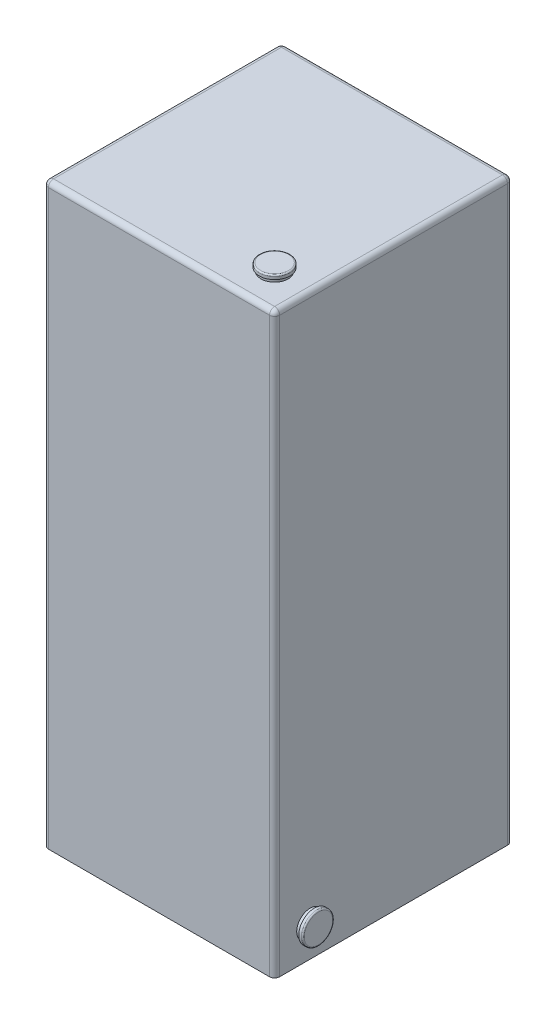
from build123d import *

# Parameters (mm, degrees)
CROQUIS1_W              = 680
CROQUIS1_H              = 1700
SALIENTE_EXTRUIR1_DEPTH = 700
REDONDEO1_R             = 15
CROQUIS4_R              = 40
SALIENTE_EXTRUIR4_DEPTH = 22
CROQUIS5_R              = 45
SALIENTE_EXTRUIR5_DEPTH = 12
REDONDEO3_R             = 4
CROQUIS6_R              = 40
SALIENTE_EXTRUIR6_DEPTH = 24
CROQUIS7_R              = 46
SALIENTE_EXTRUIR7_DEPTH = 12
REDONDEO5_R             = 4


with BuildPart() as part:
    # Croquis1 → Saliente-Extruir1 (new body)
    with BuildSketch(Plane.XY):
        with Locations((340, 850)):
            Rectangle(CROQUIS1_W, CROQUIS1_H)
    extrude(amount=SALIENTE_EXTRUIR1_DEPTH)

    # Redondeo1
    redondeo1_edges = [part.edges().sort_by_distance(p)[0] for p in [
        (680, 850, 700),
        (340, 1700, 700),
        (0, 850, 700),
        (340, 1700, 0),
        (680, 850, 0),
        (0, 850, 0),
        (0, 1700, 350),
        (680, 1700, 350),
    ]]
    fillet(redondeo1_edges, radius=REDONDEO1_R)

    # Croquis4 → Saliente-Extruir4 (add)
    with BuildSketch(Plane(origin=(0, 1700, 0), x_dir=(1, 0, 0), z_dir=(0, 1, 0))):
        with Locations(Location((575, -595, 0), (0, 0, 90))):
            Circle(CROQUIS4_R)
    extrude(amount=SALIENTE_EXTRUIR4_DEPTH)

    # Croquis5 → Saliente-Extruir5 (add)
    with BuildSketch(Plane(origin=(0, 1722, 0), x_dir=(1, 0, 0), z_dir=(0, 1, 0))):
        with Locations(Location((575, -595, 0), (0, 0, 270))):
            Circle(CROQUIS5_R)
    extrude(amount=-SALIENTE_EXTRUIR5_DEPTH)

    # Redondeo3
    redondeo3_edges = [part.edges().sort_by_distance(p)[0] for p in [
        (575, 1722, 550),
    ]]
    fillet(redondeo3_edges, radius=REDONDEO3_R)

    # Croquis6 → Saliente-Extruir6 (add)
    with BuildSketch(Plane(origin=(680, 0, 0), x_dir=(0, 0, -1), z_dir=(1, 0, 0))):
        with Locations(Location((-595, 90, 0), (0, 0, 180))):
            Circle(CROQUIS6_R)
    extrude(amount=SALIENTE_EXTRUIR6_DEPTH)

    # Croquis7 → Saliente-Extruir7 (add)
    with BuildSketch(Plane(origin=(704, 0, 0), x_dir=(0, 0, -1), z_dir=(1, 0, 0))):
        with Locations((-595, 90)):
            Circle(CROQUIS7_R)
    extrude(amount=-SALIENTE_EXTRUIR7_DEPTH)

    # Redondeo5
    redondeo5_edges = [part.edges().sort_by_distance(p)[0] for p in [
        (704, 90, 641),
    ]]
    fillet(redondeo5_edges, radius=REDONDEO5_R)


solid = part.part
